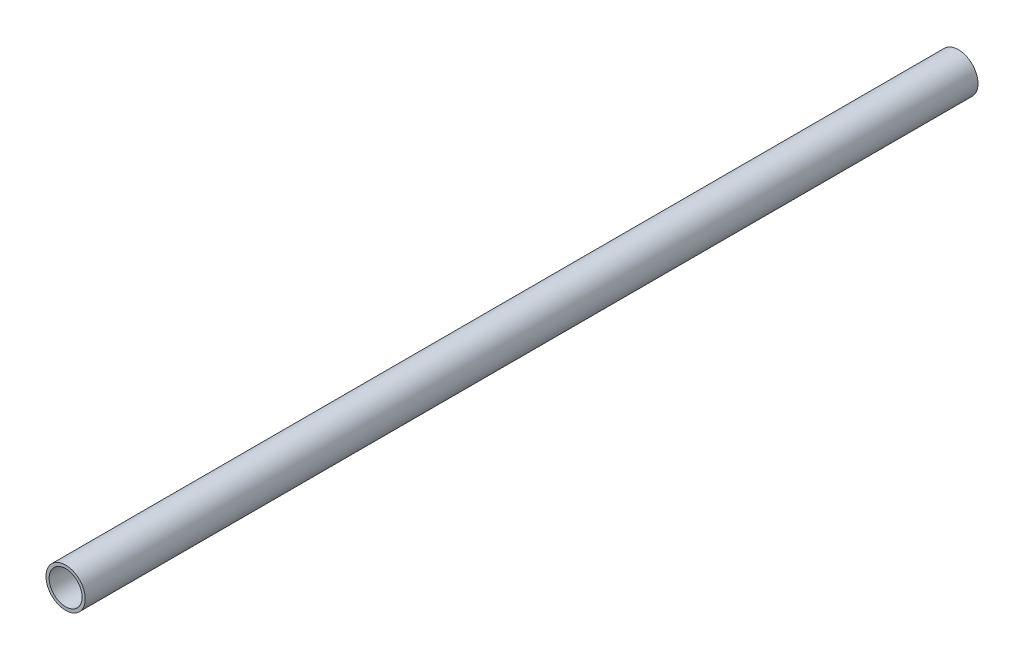
from build123d import *

# Parameters (mm, degrees)
CROQUIS1_R              = 12.5
CROQUIS1_R_2            = 10.5
SALIENTE_EXTRUIR1_DEPTH = 568


with BuildPart() as part:
    # Croquis1 → Saliente-Extruir1 (new body)
    with BuildSketch(Plane.XY):
        Circle(CROQUIS1_R)
        Circle(CROQUIS1_R_2, mode=Mode.SUBTRACT)
    extrude(amount=SALIENTE_EXTRUIR1_DEPTH)


solid = part.part
